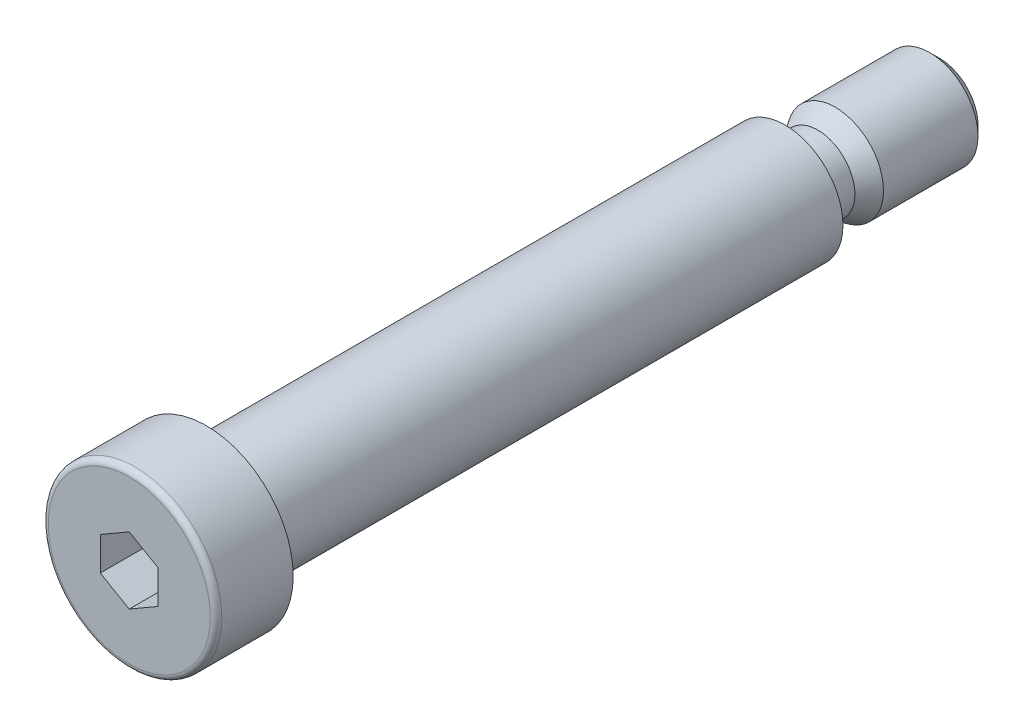
from build123d import *

# Parameters (mm, degrees)
SZKIC1_W                   = 3.85
SZKIC1_H                   = 3.39
WYTNIJ_WYCI_GNI_CIE1_DEPTH = 4.9
ZAOKR_GLENIE1_R            = 0.6


with BuildPart() as part:
    # Szkic1 → Obrót1 (revolve)
    with BuildSketch(Plane(origin=(0, 0, 0), x_dir=(1, 0, 0), z_dir=(0, 1, 0)), mode=Mode.PRIVATE) as obr_t1_sk:
        Polygon((0, -38), (0, -30), (-6, -30), (-9, -30), (-9, -38), align=None)
        Polygon((0, -30), (0, 30), (-3.85, 30), (-6, 30), (-6, -30), align=None)
        with Locations((-1.925, 31.695)):
            Rectangle(SZKIC1_W, SZKIC1_H)
        Polygon((-3.85, 33.39), (0, 33.39), (0, 46), (-4, 46), (-5, 45), (-5, 35.2), align=None)
    revolve(obr_t1_sk.sketch.rotate(Axis((0, 0, 38), (0, 0, -1)), 180), axis=Axis((0, 0, 38), (0, 0, -1)))

    # Szkic2 → Wytnij-wyciągnięcie1 (cut)
    with BuildSketch(Plane.XY.offset(38)):
        Polygon((3, 1.732050808), (0, 3.464101615), (-3, 1.732050808), (-3, -1.732050808), (0, -3.464101615), (3, -1.732050808), align=None)
    extrude(amount=-WYTNIJ_WYCI_GNI_CIE1_DEPTH, mode=Mode.SUBTRACT)

    # Zaokrąglenie1
    zaokr_glenie1_edges = [part.edges().sort_by_distance(p)[0] for p in [
        (-9, 0, 38),
    ]]
    fillet(zaokr_glenie1_edges, radius=ZAOKR_GLENIE1_R)


solid = part.part
